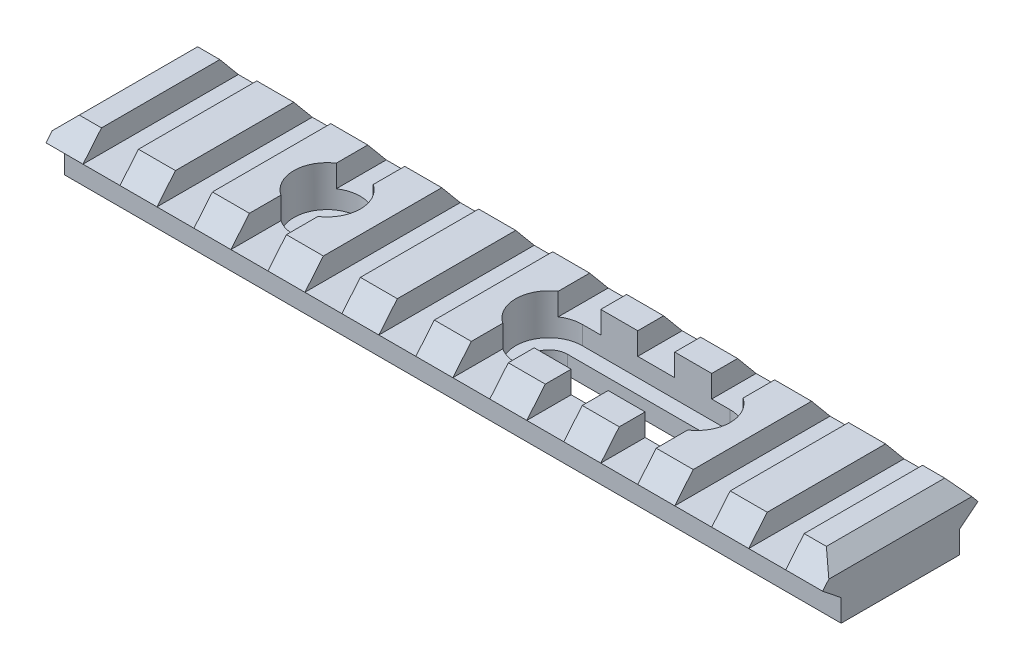
from build123d import *

# Parameters (mm, degrees)
EXTRUDE_1_DEPTH          = 52.5
SKETCH_2_W               = 5
SKETCH_2_H               = 21
CUT_EXTRUDE_1_DEPTH      = 3
CUT_EXTRUDE_2_DEPTH      = 55.13409277
CUT_EXTRUDE_2_DEPTH_BACK = 55.13409277
SKETCH_3_R               = 2.5
CUT_EXTRUDE_3_DEPTH      = 55.13409277
SKETCH_5_R               = 4.5
CUT_EXTRUDE_4_DEPTH      = 5.5


with BuildPart() as part:
    # 草图1 → 凸台-拉伸1 (new, symmetric)
    with BuildSketch(Plane(origin=(0, 0, 0), x_dir=(0, 0, -1), z_dir=(1, 0, 0))):
        Polygon((-8, 0), (8, 0), (8, 3), (10.5, 5), (8, 8), (-8, 8), (-10.5, 5), (-8, 3), align=None)
    extrude(amount=EXTRUDE_1_DEPTH, both=True)

    # 草图2 → 切除-拉伸1 (cut)
    with BuildSketch(Plane(origin=(0, 8, 0), x_dir=(1, 0, 0), z_dir=(0, 1, 0))):
        with Locations((-5, 0)):
            Rectangle(SKETCH_2_W, SKETCH_2_H)
        with Locations((45, 0)):
            Rectangle(SKETCH_2_W, SKETCH_2_H)
        with Locations((-15, 0)):
            Rectangle(SKETCH_2_W, SKETCH_2_H)
        with Locations((-25, 0)):
            Rectangle(SKETCH_2_W, SKETCH_2_H)
        with Locations((-35, 0)):
            Rectangle(SKETCH_2_W, SKETCH_2_H)
        with Locations((-45, 0)):
            Rectangle(SKETCH_2_W, SKETCH_2_H)
        with Locations((35, 0)):
            Rectangle(SKETCH_2_W, SKETCH_2_H)
        with Locations((25, 0)):
            Rectangle(SKETCH_2_W, SKETCH_2_H)
        with Locations((15, 0)):
            Rectangle(SKETCH_2_W, SKETCH_2_H)
        with Locations((5, 0)):
            Rectangle(SKETCH_2_W, SKETCH_2_H)
    extrude(amount=-CUT_EXTRUDE_1_DEPTH, mode=Mode.SUBTRACT)

    # 草图3 → 切除-拉伸2 (cut, two sides: drawn at the far end of the back side and taken through both)
    with BuildSketch(Plane.XZ.offset(-CUT_EXTRUDE_2_DEPTH_BACK)):
        with Locations(Location((-25, 0, 0), (0, 0, 180))):
            Circle(SKETCH_3_R)
        with BuildLine():
            Line((5, 2.5), (25, 2.5))
            ThreePointArc((25, 2.5), (27.5, 0), (25, -2.5))
            Line((25, -2.5), (5, -2.5))
            ThreePointArc((5, -2.5), (2.5, 0), (5, 2.5))
        make_face()
    extrude(amount=CUT_EXTRUDE_2_DEPTH + CUT_EXTRUDE_2_DEPTH_BACK, mode=Mode.SUBTRACT)

    # 草图4 → 切除-拉伸3 (cut, symmetric)
    with BuildSketch(Plane.XY):
        Polygon((-52.5, 6), (-50.5, 8), (-52.5, 8), align=None)
    cut_extrude_3 = extrude(amount=CUT_EXTRUDE_3_DEPTH, both=True, mode=Mode.SUBTRACT)

    # 镜向1: 切除-拉伸3 across plane
    add(cut_extrude_3.mirror(Plane(origin=(0, 0, 0), x_dir=(0, 0, 1), z_dir=(1, 0, 0))), mode=Mode.SUBTRACT)

    # 草图5 → 切除-拉伸4 (cut)
    # profile 1 of 2: a face of its own
    with BuildSketch(Plane(origin=(0, 8, 0), x_dir=(1, 0, 0), z_dir=(0, 1, 0))):
        with Locations(Location((-25, 0, 0), (0, 0, 270))):
            Circle(SKETCH_5_R)
    # profile 2 of 2: a face of its own
    with BuildSketch(Plane(origin=(0, 8, 0), x_dir=(1, 0, 0), z_dir=(0, 1, 0))):
        with BuildLine():
            Line((5, 4.5), (25, 4.5))
            ThreePointArc((25, 4.5), (29.5, 0), (25, -4.5))
            Line((25, -4.5), (5, -4.5))
            ThreePointArc((5, -4.5), (0.5, 0), (5, 4.5))
        make_face()
        with BuildLine():
            Line((7.5, -2.5), (5, -2.5))
            ThreePointArc((5, -2.5), (3.232233047, -1.767766953), (2.5, 0))
            ThreePointArc((2.5, 0), (3.232233047, 1.767766953), (5, 2.5))
            Line((5, 2.5), (7.5, 2.5))
            Line((7.5, 2.5), (12.5, 2.5))
            Line((12.5, 2.5), (17.5, 2.5))
            Line((17.5, 2.5), (22.5, 2.5))
            Line((22.5, 2.5), (25, 2.5))
            ThreePointArc((25, 2.5), (26.767766953, 1.767766953), (27.5, 0))
            ThreePointArc((27.5, 0), (26.767766953, -1.767766953), (25, -2.5))
            Line((25, -2.5), (22.5, -2.5))
            Line((22.5, -2.5), (17.5, -2.5))
            Line((17.5, -2.5), (12.5, -2.5))
            Line((12.5, -2.5), (7.5, -2.5))
        make_face(mode=Mode.SUBTRACT)
    extrude(amount=-CUT_EXTRUDE_4_DEPTH, mode=Mode.SUBTRACT)


solid = part.part
